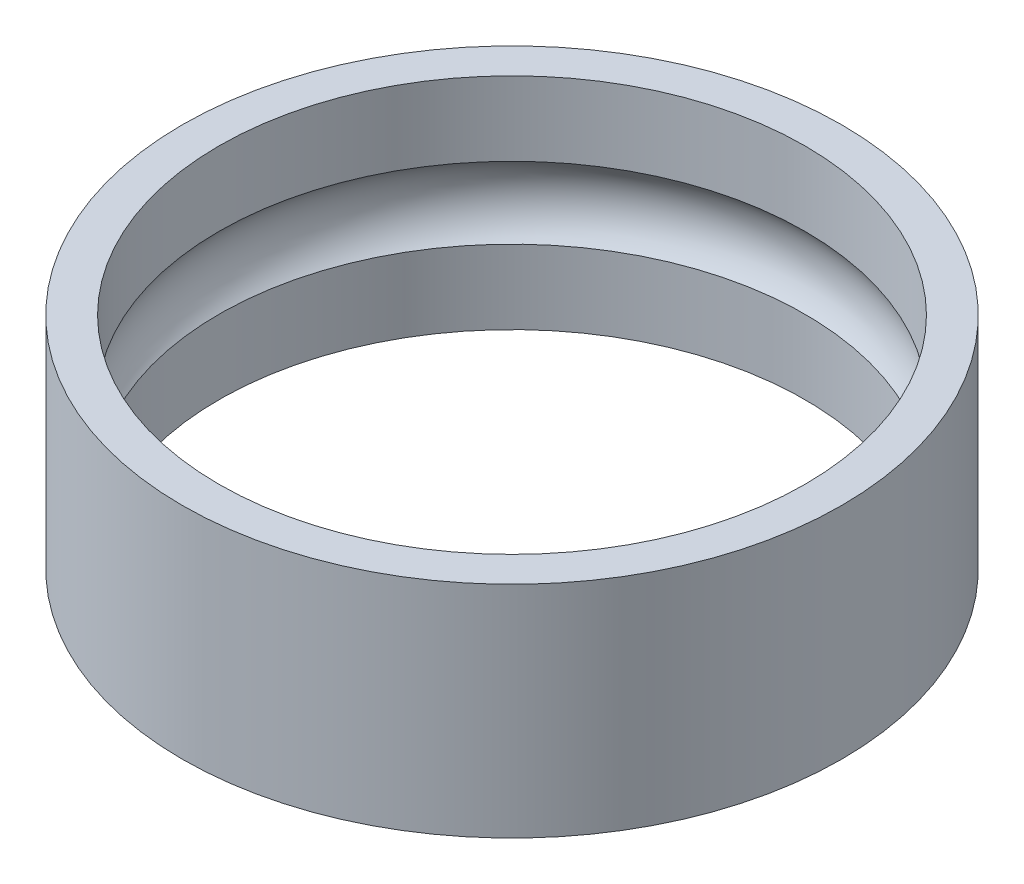
from build123d import *

# Parameters (mm, degrees)
DIAMETER_PROFILE_SKETCH_R     = 4.5
DIAMETER_PROFILE_SKETCH_R_2   = 4
DIAMETER_PROFILE_DEPTH        = 1.5
BEARING_PATH_PROFILE_SKETCH_R = 0.7


with BuildPart() as part:
    # Diameter Profile Sketch → Diameter Profile (new, symmetric)
    with BuildSketch(Plane(origin=(0, 0, 0), x_dir=(1, 0, 0), z_dir=(0, 1, 0))):
        with Locations(Location((0, 0, 0), (0, 0, 270))):
            Circle(DIAMETER_PROFILE_SKETCH_R)
        with Locations(Location((0, 0, 0), (0, 0, 270))):
            Circle(DIAMETER_PROFILE_SKETCH_R_2, mode=Mode.SUBTRACT)
    extrude(amount=DIAMETER_PROFILE_DEPTH, both=True)

    # Bearing Path Profile Sketch → Bearing Path Profile (revolve, cut)
    with BuildSketch(Plane.XY, mode=Mode.PRIVATE) as bearing_path_profile_sk:
        with Locations((3.5, 0)):
            Circle(BEARING_PATH_PROFILE_SKETCH_R)
    revolve(bearing_path_profile_sk.sketch.rotate(Axis((0, 1.5, 0), (0, -1, 0)), 90), axis=Axis((0, 1.5, 0), (0, -1, 0)), mode=Mode.SUBTRACT)


solid = part.part
